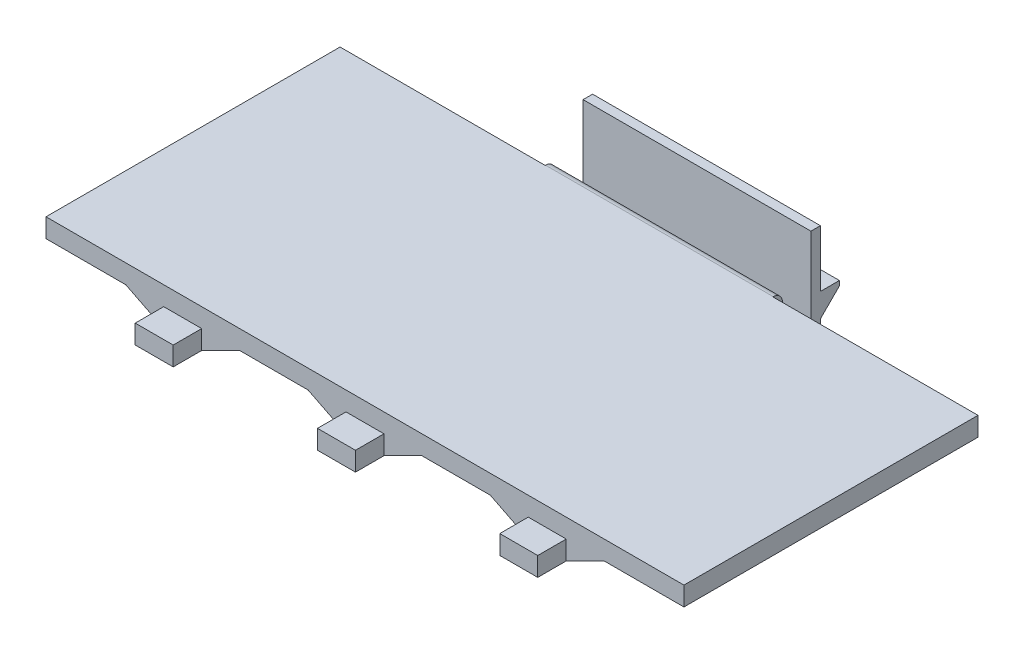
from build123d import *

# Parameters (mm, degrees)
SKETCH1_W                = 53.34
SKETCH1_H                = 24.5872
BOSS_EXTRUDE1_DEPTH      = 1.5875
SKETCH2_W                = 3.175
SKETCH2_H                = 2.38125
BOSS_EXTRUDE2_DEPTH      = 1.5875
BOSS_EXTRUDE2_2_DEPTH    = 1.5875
BOSS_EXTRUDE2_3_DEPTH    = 1.5875
LPATTERN1_COUNT          = 3
LPATTERN1_PITCH          = 15.24
BOSS_EXTRUDE3_DEPTH      = 9.525
BOSS_EXTRUDE3_DEPTH_BACK = 9.525
FILLET1_R                = 0.762


with BuildPart() as part:
    # Sketch1 → Boss-Extrude1 (new body)
    with BuildSketch(Plane(origin=(0, 0, 0), x_dir=(1, 0, 0), z_dir=(0, 1, 0))):
        with Locations((26.67, 12.2936)):
            Rectangle(SKETCH1_W, SKETCH1_H)
    extrude(amount=BOSS_EXTRUDE1_DEPTH)



with BuildPart() as body_2:
    # Sketch2 → Boss-Extrude2 (new body)
    with BuildSketch(Plane.XZ):
        with Locations((11.43, 1.190625)):
            Rectangle(SKETCH2_W, SKETCH2_H)
    extrude(amount=BOSS_EXTRUDE2_DEPTH)


with BuildPart() as body_3:
    # Sketch2 → Boss-Extrude2 2 (new body)
    with BuildSketch(Plane.XZ):
        with Locations((26.67, 1.190625)):
            Rectangle(SKETCH2_W, SKETCH2_H)
    extrude(amount=BOSS_EXTRUDE2_2_DEPTH)


with BuildPart() as body_4:
    # Sketch2 → Boss-Extrude2 3 (new body)
    with BuildSketch(Plane.XZ):
        with Locations((41.91, 1.190625)):
            Rectangle(SKETCH2_W, SKETCH2_H)
    extrude(amount=BOSS_EXTRUDE2_3_DEPTH)


with BuildPart() as part_1:
    add(part.part)

    add(body_4.part)  # Loft2 merges body 4
    # Sketch5 → Loft2 section 0
    with BuildSketch(Plane.XZ):
        with BuildLine():
            Line((37.1475, 0), (46.6725, 0))
            Line((46.6725, 0), (46.6725, -6.35))
            Line((46.6725, -6.35), (37.1475, -6.35))
            Line((37.1475, -6.35), (37.1475, 0))
        make_face()
    # Sketch4 → Loft2 section 1
    with BuildSketch(Plane.XZ.offset(1.5875)):
        with BuildLine():
            Line((43.4975, 0), (40.3225, 0))
            Line((40.3225, 0), (40.3225, -3.175))
            Line((40.3225, -3.175), (43.4975, -3.175))
            Line((43.4975, -3.175), (43.4975, 0))
        make_face()
    loft2 = loft()


    add(body_2.part)  # LPattern1 merges body 2

    add(body_3.part)  # LPattern1 merges body 3
    # LPattern1: Loft2 ×3
    with Locations(*[(-i * LPATTERN1_PITCH, 0, 0) for i in range(1, LPATTERN1_COUNT)]):
        add(loft2)

    # Sketch7 → Boss-Extrude3 (add, two sides: drawn at the far end of the back side and taken through both)
    with BuildSketch(Plane.ZY.offset(-26.67).offset(-BOSS_EXTRUDE3_DEPTH_BACK)):
        Polygon((-30.14345, -0.396875), (-28.55595, -1.984375), (-28.55595, -4.7625), (-26.212479769, -4.7625), (-24.5872, -4.7625), (-24.5872, 1.5875), (-25.38095, 1.5875), (-25.38095, -3.96875), (-27.7622, -3.96875), (-27.7622, 4.7625), (-28.55595, 4.7625), (-28.55595, 0), (-30.14345, 0), align=None)
    extrude(amount=BOSS_EXTRUDE3_DEPTH + BOSS_EXTRUDE3_DEPTH_BACK)

    # Fillet1
    fillet1_edges = [part_1.edges().sort_by_distance(p)[0] for p in [
        (26.67, -3.96875, -27.7622),
        (26.67, -3.96875, -25.38095),
        (26.67, 1.5875, -25.38095),
        (26.67, -4.7625, -24.5872),
        (26.67, -4.7625, -28.55595),
    ]]
    fillet(fillet1_edges, radius=FILLET1_R)


solid = part_1.part
